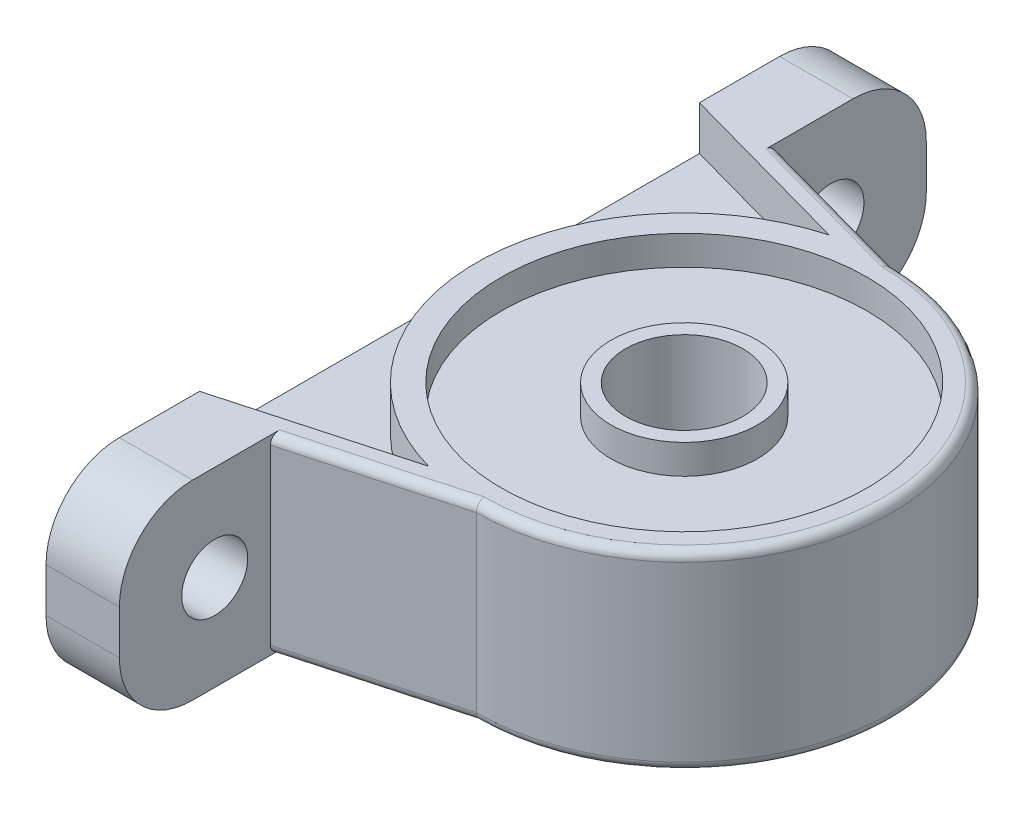
from build123d import *

# Parameters (mm, degrees)
SKETCH_1_R          = 12.458976409
EXTRUDE_1_DEPTH     = 13
SKETCH_1_R_2        = 5
SKETCH_1_R_3        = 4
EXTRUDE_1_2_DEPTH   = 13
EXTRUDE_START       = 2
SKETCH_1_3_R        = 12.458976409
SKETCH_1_3_R_2      = 5
EXTRUDE_2_DEPTH     = 9
SKETCH_2_R          = 2.25
CUT_EXTRUDE_1_DEPTH = 9
FILLET_1_R          = 5
EXTRUDE_START_2     = 3
SKETCH_3_R          = 5
SKETCH_3_R_2        = 4
EXTRUDE_3_DEPTH     = 3
CUT_EXTRUDE_2_DEPTH = 3
FILLET_2_R          = 0.6


with BuildPart() as part:
    # Эскиз1 → Бобышка-Вытянуть1 (new body)
    with BuildSketch(Plane(origin=(0, 0, 0), x_dir=(1, 0, 0), z_dir=(0, 1, 0))):
        with BuildLine():
            Line((-11, 27.5), (-16, 27.5))
            Line((-16, 27.5), (-16, -27.5))
            Line((-16, -27.5), (-11, -27.5))
            Line((-11, -27.5), (-11, -17.206839795))
            Line((-11, -17.206839795), (0, -14.162262157))
            ThreePointArc((0, -14.162262157), (14.162262157, 0), (0, 14.162262157))
            Line((0, 14.162262157), (-11, 17.206839795))
            Line((-11, 17.206839795), (-11, 27.5))
        make_face()
        Circle(SKETCH_1_R, mode=Mode.SUBTRACT)
    extrude(amount=EXTRUDE_1_DEPTH)



with BuildPart() as body_2:
    # Эскиз1 → Extrude 1 2 (new body)
    with BuildSketch(Plane(origin=(0, 0, 0), x_dir=(1, 0, 0), z_dir=(0, 1, 0))):
        Circle(SKETCH_1_R_2)
        Circle(SKETCH_1_R_3, mode=Mode.SUBTRACT)
    extrude(amount=EXTRUDE_1_2_DEPTH)


with BuildPart() as part_1:
    add(part.part)

    add(body_2.part)  # Бобышка-Вытянуть2 merges body 2
    # Эскиз1<3> → Бобышка-Вытянуть2 (add)
    with BuildSketch(Plane(origin=(0, 0, 0), x_dir=(1, 0, 0), z_dir=(0, 1, 0)).offset(EXTRUDE_START)):
        Circle(SKETCH_1_3_R)
        Circle(SKETCH_1_3_R_2, mode=Mode.SUBTRACT)
    extrude(amount=EXTRUDE_2_DEPTH)

    # Эскиз2 → Вырез-Вытянуть1 (cut)
    with BuildSketch(Plane(origin=(-11, 0, 0), x_dir=(0, 0, -1), z_dir=(1, 0, 0))):
        with Locations((21, 6.5)):
            Circle(SKETCH_2_R)
        with Locations((-21, 6.5)):
            Circle(SKETCH_2_R)
    extrude(amount=-CUT_EXTRUDE_1_DEPTH, mode=Mode.SUBTRACT)

    # Скругление1
    fillet_1_edges = [part_1.edges().sort_by_distance(p)[0] for p in [
        (-13.5, 0, 27.5),
        (-13.5, 13, 27.5),
        (-13.5, 13, -27.5),
        (-13.5, 0, -27.5),
    ]]
    fillet(fillet_1_edges, radius=FILLET_1_R)

    # Эскиз3 → Бобышка-Вытянуть3 (add)
    with BuildSketch(Plane.XZ.offset(EXTRUDE_START_2)):
        Circle(SKETCH_3_R)
        Circle(SKETCH_3_R_2, mode=Mode.SUBTRACT)
    extrude(amount=-EXTRUDE_3_DEPTH)

    # Эскиз4 → Вырез-Вытянуть2 (cut)
    with BuildSketch(Plane.XZ):
        with BuildLine():
            Line((-16, -17.034343572), (-3.773486703, -13.650291847))
            ThreePointArc((-3.773486703, -13.650291847), (-14.162262157, 0), (-3.773486703, 13.650291847))
            Line((-3.773486703, 13.650291847), (-16, 17.034343572))
            Line((-16, 17.034343572), (-16, -17.034343572))
        make_face()
    cut_extrude_2 = extrude(amount=-CUT_EXTRUDE_2_DEPTH, mode=Mode.SUBTRACT)

    # Зеркальное отражение1: Вырез-Вытянуть2 across plane
    add(cut_extrude_2.mirror(Plane.ZX.offset(6.5)), mode=Mode.SUBTRACT)

    # Скругление2
    fillet_2_edges = [part_1.edges().sort_by_distance(p)[0] for p in [
        (-5.5, 13, 15.684550976),
        (-5.5, 13, -15.684550976),
        (14.162262157, 13, 0),
        (-5.5, 0, 15.684550976),
        (-5.5, 0, -15.684550976),
        (14.162262157, 0, 0),
    ]]
    fillet(fillet_2_edges, radius=FILLET_2_R)


solid = part_1.part
